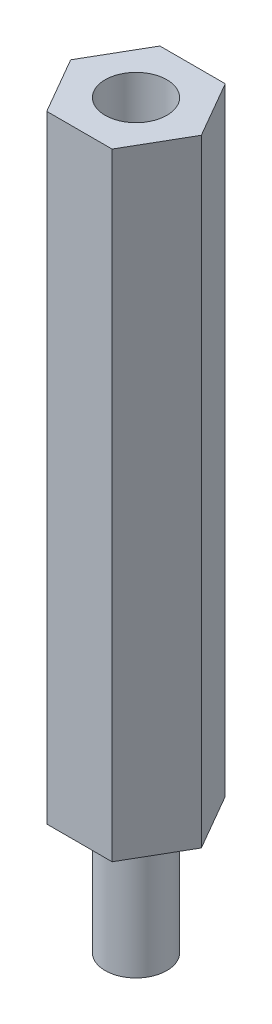
from build123d import *

# Parameters (mm, degrees)
BOSS_EXTRUDE1_DEPTH = 30
SKETCH2_R           = 1.5
CUT_EXTRUDE1_DEPTH  = 12
SKETCH3_R           = 1.5
BOSS_EXTRUDE2_DEPTH = 6


with BuildPart() as part:
    # Sketch1 → Boss-Extrude1 (new body)
    with BuildSketch(Plane(origin=(0, 0, 0), x_dir=(1, 0, 0), z_dir=(0, 1, 0))):
        Polygon((3.175426481, 0), (1.58771324, 2.75), (-1.58771324, 2.75), (-3.175426481, 0), (-1.58771324, -2.75), (1.58771324, -2.75), align=None)
    extrude(amount=BOSS_EXTRUDE1_DEPTH)

    # Sketch2 → Cut-Extrude1 (cut)
    with BuildSketch(Plane(origin=(0, 30, 0), x_dir=(1, 0, 0), z_dir=(0, 1, 0))):
        with Locations(Location((0, 0, 0), (0, 0, 270))):
            Circle(SKETCH2_R)
    extrude(amount=-CUT_EXTRUDE1_DEPTH, mode=Mode.SUBTRACT)

    # Sketch3 → Boss-Extrude2 (add)
    with BuildSketch(Plane(origin=(0, 0, 0), x_dir=(-1, 0, 0), z_dir=(0, -1, 0))):
        with Locations(Location((0, 0, 0), (0, 0, 270))):
            Circle(SKETCH3_R)
    extrude(amount=BOSS_EXTRUDE2_DEPTH)


solid = part.part
